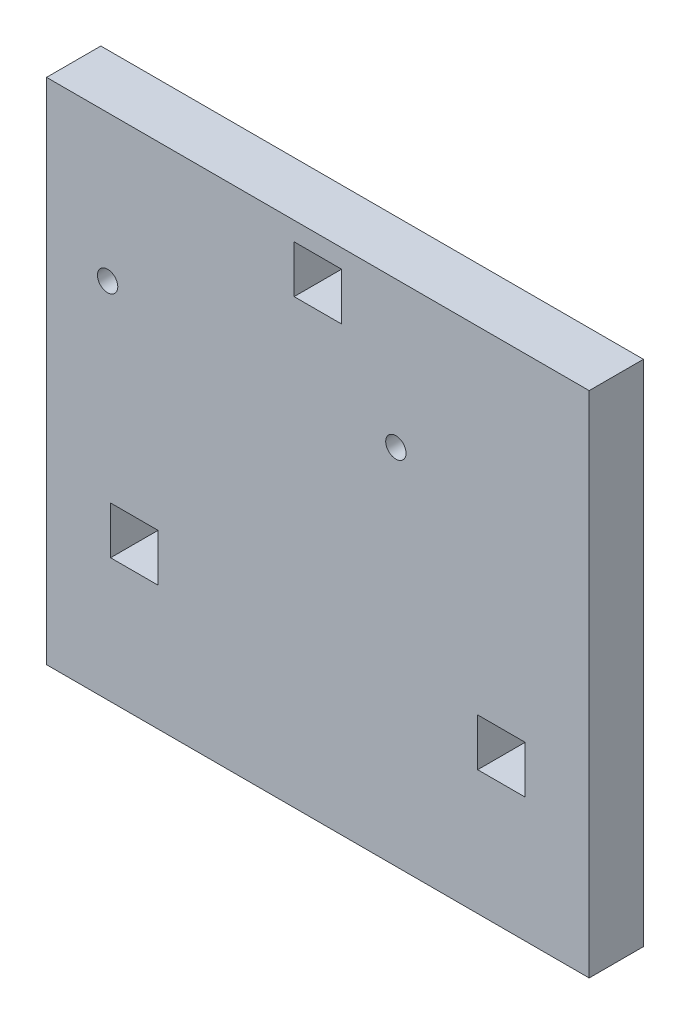
from build123d import *

# Parameters (mm, degrees)
SKETCH1_W           = 160
SKETCH1_H           = 150
BOSS_EXTRUDE1_DEPTH = 16
SKETCH2_W           = 14
SKETCH2_H           = 14
CUT_EXTRUDE1_DEPTH  = 14
SKETCH3_R           = 3
CUT_EXTRUDE2_DEPTH  = 220.899977262


with BuildPart() as part:
    # Sketch1 → Boss-Extrude1 (new body)
    with BuildSketch(Plane.XY):
        with Locations((-80, -75)):
            Rectangle(SKETCH1_W, SKETCH1_H)
    extrude(amount=BOSS_EXTRUDE1_DEPTH)

    # Sketch2 → Cut-Extrude1 (cut)
    with BuildSketch(Plane.XY.offset(16)):
        with Locations((-80, -12.5)):
            Rectangle(SKETCH2_W, SKETCH2_H)
        with Locations((-134.126587737, -106.25)):
            Rectangle(SKETCH2_W, SKETCH2_H)
        with Locations((-25.873412263, -106.25)):
            Rectangle(SKETCH2_W, SKETCH2_H)
    extrude(amount=-CUT_EXTRUDE1_DEPTH, mode=Mode.SUBTRACT)

    # Sketch3 → Cut-Extrude2 (cut, through all)
    with BuildSketch(Plane.XY.offset(16)):
        with Locations((-57, -43)):
            Circle(SKETCH3_R)
        with Locations((-142, -43)):
            Circle(SKETCH3_R)
    extrude(amount=-CUT_EXTRUDE2_DEPTH, mode=Mode.SUBTRACT)


solid = part.part
